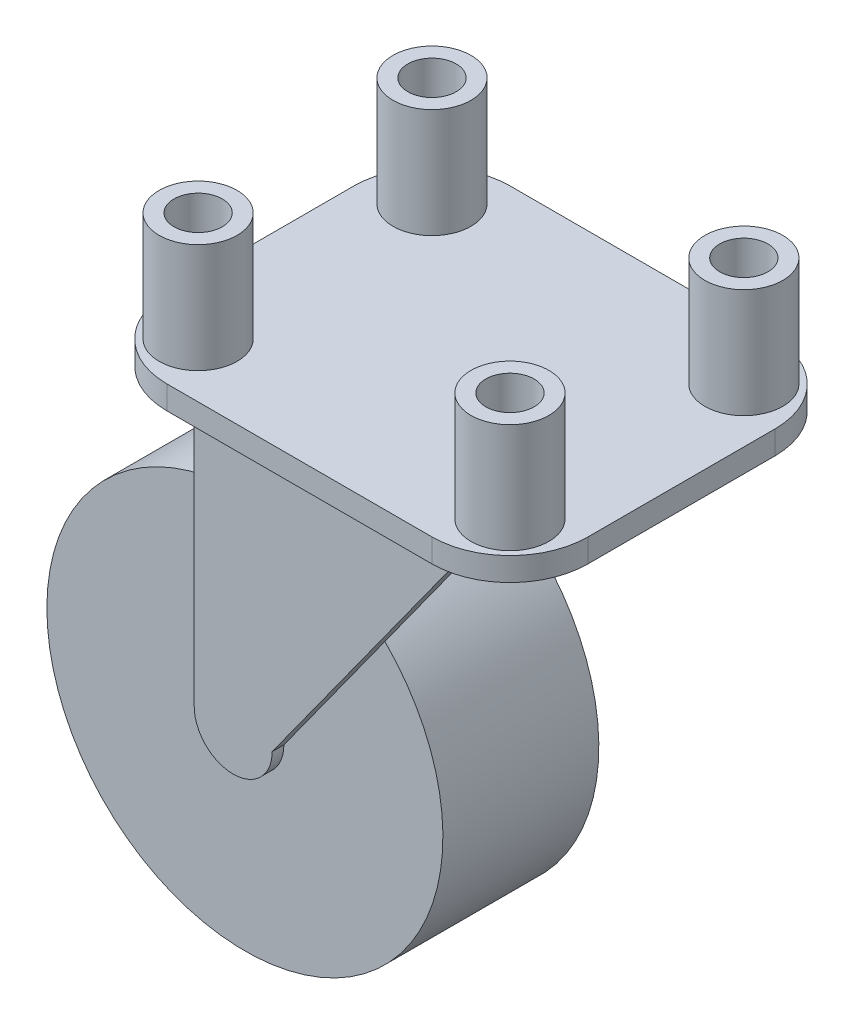
from build123d import *

# Parameters (mm, degrees)
EXTRUDE_1_DEPTH      = 10
EXTRUDE_1_DEPTH_BACK = 10
SKETCH_1_R           = 25.4
EXTRUDE_2_DEPTH      = 1.5
SKETCH_3_W           = 54
SKETCH_3_H           = 44
EXTRUDE_3_DEPTH      = 3
SKETCH_4_R           = 3.1
CUT_EXTRUDE_1_DEPTH  = 3
FILLET_1_R           = 10
EXTRUDE_START        = 14
SKETCH_5_R           = 5
SKETCH_5_R_2         = 3.1
EXTRUDE_4_DEPTH      = 14


with BuildPart() as part:
    # 草图1 → 凸台-拉伸1 (new, two sides: drawn at the far end of the back side and taken through both)
    with BuildSketch(Plane.XY.offset(-EXTRUDE_1_DEPTH_BACK)):
        Circle(SKETCH_1_R)
    extrude(amount=EXTRUDE_1_DEPTH + EXTRUDE_1_DEPTH_BACK)

    # 草图2 → 凸台-拉伸2 (add)
    with BuildSketch(Plane.XY.offset(10)):
        with BuildLine():
            Line((-5, 0), (-5, 41.6))
            Line((-5, 41.6), (35, 41.6))
            Line((35, 41.6), (5, 0))
            ThreePointArc((5, 0), (0, -5), (-5, 0))
        make_face()
    extrude_2 = extrude(amount=EXTRUDE_2_DEPTH)

    # 镜向1: 凸台-拉伸2 across plane
    add(extrude_2.mirror(Plane.XY))

    # 草图3 → 凸台-拉伸3 (add)
    with BuildSketch(Plane(origin=(0, 41.6, 0), x_dir=(1, 0, 0), z_dir=(0, 1, 0))):
        with Locations((19, 0)):
            Rectangle(SKETCH_3_W, SKETCH_3_H)
    extrude(amount=EXTRUDE_3_DEPTH)

    # 草图4 → 切除-拉伸1 (cut)
    with BuildSketch(Plane(origin=(0, 44.6, 0), x_dir=(1, 0, 0), z_dir=(0, 1, 0))):
        with Locations(Location((-1, 15, 0), (0, 0, 270))):
            Circle(SKETCH_4_R)
        with Locations(Location((39, 15, 0), (0, 0, 270))):
            Circle(SKETCH_4_R)
        with Locations(Location((39, -15, 0), (0, 0, 270))):
            Circle(SKETCH_4_R)
        with Locations(Location((-1, -15, 0), (0, 0, 270))):
            Circle(SKETCH_4_R)
    extrude(amount=-CUT_EXTRUDE_1_DEPTH, mode=Mode.SUBTRACT)

    # 圆角1
    fillet_1_edges = [part.edges().sort_by_distance(p)[0] for p in [
        (-8, 43.1, -22),
        (-8, 43.1, 22),
        (46, 43.1, 22),
        (46, 43.1, -22),
    ]]
    fillet(fillet_1_edges, radius=FILLET_1_R)

    # 草图5 → 凸台-拉伸4 (add)
    # profile 1 of 4: a face of its own
    with BuildSketch(Plane(origin=(0, 44.6, 0), x_dir=(1, 0, 0), z_dir=(0, 1, 0)).offset(EXTRUDE_START)):
        with Locations(Location((-1, 15, 0), (0, 0, 270))):
            Circle(SKETCH_5_R)
        with Locations(Location((-1, 15, 0), (0, 0, 270))):
            Circle(SKETCH_5_R_2, mode=Mode.SUBTRACT)
    # profile 2 of 4: a face of its own
    with BuildSketch(Plane(origin=(0, 44.6, 0), x_dir=(1, 0, 0), z_dir=(0, 1, 0)).offset(EXTRUDE_START)):
        with Locations(Location((39, 15, 0), (0, 0, 270))):
            Circle(SKETCH_5_R)
        with Locations(Location((39, 15, 0), (0, 0, 270))):
            Circle(SKETCH_5_R_2, mode=Mode.SUBTRACT)
    # profile 3 of 4: a face of its own
    with BuildSketch(Plane(origin=(0, 44.6, 0), x_dir=(1, 0, 0), z_dir=(0, 1, 0)).offset(EXTRUDE_START)):
        with Locations(Location((-1, -15, 0), (0, 0, 270))):
            Circle(SKETCH_5_R)
        with Locations(Location((-1, -15, 0), (0, 0, 270))):
            Circle(SKETCH_5_R_2, mode=Mode.SUBTRACT)
    # profile 4 of 4: a face of its own
    with BuildSketch(Plane(origin=(0, 44.6, 0), x_dir=(1, 0, 0), z_dir=(0, 1, 0)).offset(EXTRUDE_START)):
        with Locations(Location((39, -15, 0), (0, 0, 270))):
            Circle(SKETCH_5_R)
        with Locations(Location((39, -15, 0), (0, 0, 270))):
            Circle(SKETCH_5_R_2, mode=Mode.SUBTRACT)
    extrude(amount=-EXTRUDE_4_DEPTH)


solid = part.part
